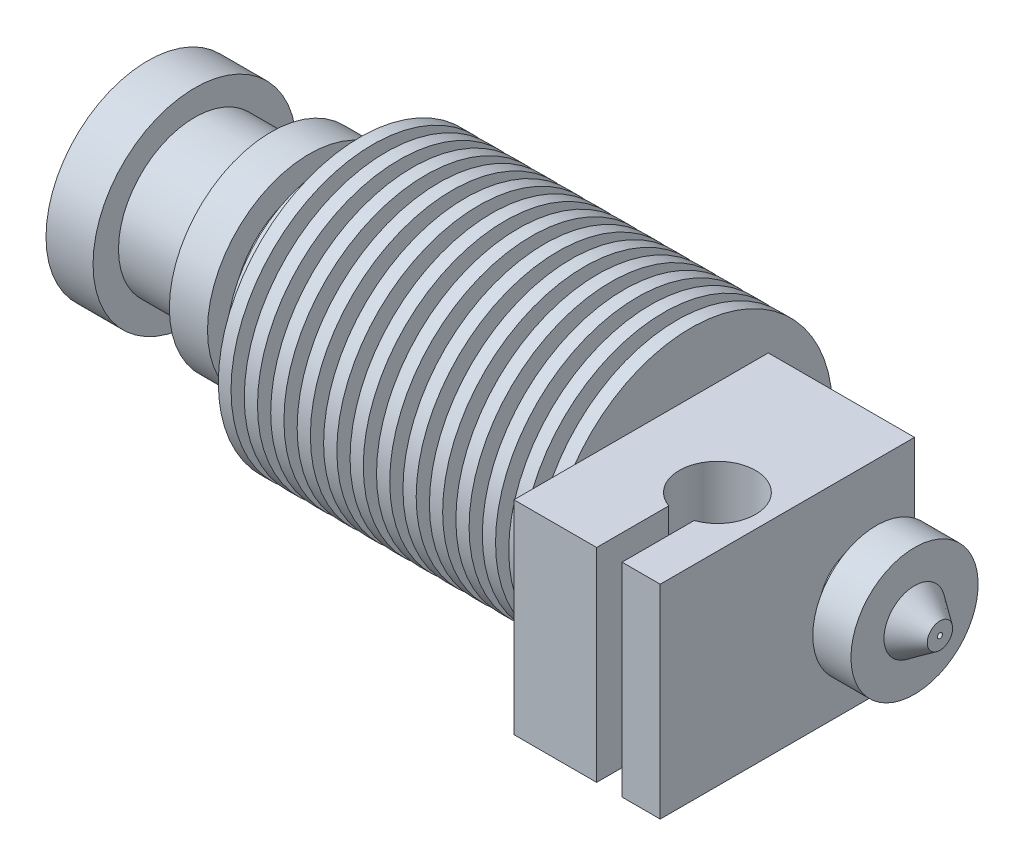
from build123d import *

# Parameters (mm, degrees)
BOSS_EXTRUDE1_DEPTH      = 6
BOSS_EXTRUDE1_DEPTH_BACK = 5.5
SKETCH3_W                = 20
SKETCH3_H                = 16
SKETCH3_R                = 3
CUT_EXTRUDE1_DEPTH       = 67.994496043


with BuildPart() as part:
    # Sketch1 → Revolve1 (revolve)
    with BuildSketch(Plane.XY, mode=Mode.PRIVATE) as revolve1_sk:
        Polygon((0, 2.1), (27.9, 2.1), (27.9, 3.5), (42.7, 3.5), (42.7, 11.15), (41.62, 11.15), (41.62, 9), (40.58, 9), (40.58, 11.15), (39.54, 11.15), (39.54, 9), (38.5, 9), (38.5, 11.15), (37.46, 11.15), (37.46, 9), (36.42, 9), (36.42, 11.15), (35.38, 11.15), (35.38, 9), (34.34, 9), (34.34, 11.15), (33.3, 11.15), (33.3, 9), (32.26, 9), (32.26, 11.15), (31.22, 11.15), (31.22, 9), (30.18, 9), (30.18, 11.15), (29.14, 11.15), (29.14, 9), (28.1, 9), (28.1, 11.15), (27.06, 11.15), (27.06, 9), (26.02, 9), (26.02, 11.15), (24.98, 11.15), (24.98, 9), (23.94, 9), (23.94, 11.15), (22.9, 11.15), (22.9, 9), (21.86, 9), (21.86, 11.15), (20.82, 11.15), (20.82, 9), (19.78, 9), (19.78, 11.15), (18.74, 11.15), (18.74, 9), (17.7, 9), (17.7, 11.15), (16.7, 11.15), (16.7, 6), (15.2, 6), (15.2, 8), (14.2, 8), (14.2, 6), (12.7, 6), (12.7, 8), (9.7, 8), (9.7, 6), (3.7, 6), (3.7, 8), (0, 8), align=None)
    revolve(revolve1_sk.sketch.rotate(Axis((0, 0, 0), (1, 0, 0)), 90), axis=Axis((0, 0, 0), (1, 0, 0)))


with BuildPart() as body_2:
    # Sketch2 → Revolve2 (revolve)
    with BuildSketch(Plane.XY, mode=Mode.PRIVATE) as revolve2_sk:
        Polygon((42.7, 0.5), (49.8, 0.5), (49.8, 3), (44.8, 3), (44.8, 1.4), (42.7, 1.4), (42.7, 3.5), (27.9, 3.5), (27.9, 0.5), align=None)
    revolve(revolve2_sk.sketch.rotate(Axis((27.9, 0, 0), (1, 0, 0)), 90), axis=Axis((27.9, 0, 0), (1, 0, 0)))

    # Sketch3 → Boss-Extrude1 (add, two sides: drawn at the far end of the back side and taken through both)
    with BuildSketch(Plane(origin=(49.8, 0, 0), x_dir=(0, 0, -1), z_dir=(1, 0, 0)).offset(-BOSS_EXTRUDE1_DEPTH_BACK)):
        with Locations((-5.5, 0)):
            Rectangle(SKETCH3_W, SKETCH3_H)
        Circle(SKETCH3_R, mode=Mode.SUBTRACT)
    extrude(amount=BOSS_EXTRUDE1_DEPTH + BOSS_EXTRUDE1_DEPTH_BACK)

    # Sketch4 → Revolve3 (revolve)
    with BuildSketch(Plane.XY, mode=Mode.PRIVATE) as revolve3_sk:
        Polygon((49.8, 0.2), (62.3, 0.2), (62.3, 1), (60.3, 2.400415076), (60.3, 5), (57.3, 5), (57.3, 3), (49.8, 3), align=None)
    revolve(revolve3_sk.sketch.rotate(Axis((0, 0, 0), (1, 0, 0)), 90), axis=Axis((0, 0, 0), (1, 0, 0)))

    # Sketch5 → Cut-Extrude1 (cut, through all)
    with BuildSketch(Plane(origin=(0, 8, 0), x_dir=(1, 0, 0), z_dir=(0, 1, 0))):
        with BuildLine():
            Line((50.8, -15.5), (52.8, -15.5))
            Line((52.8, -15.5), (52.8, -9.828427125))
            ThreePointArc((52.8, -9.828427125), (51.8, -4), (50.8, -9.828427125))
            Line((50.8, -9.828427125), (50.8, -15.5))
        make_face()
    extrude(amount=-CUT_EXTRUDE1_DEPTH, mode=Mode.SUBTRACT)


solid = Compound([part.part, body_2.part])
